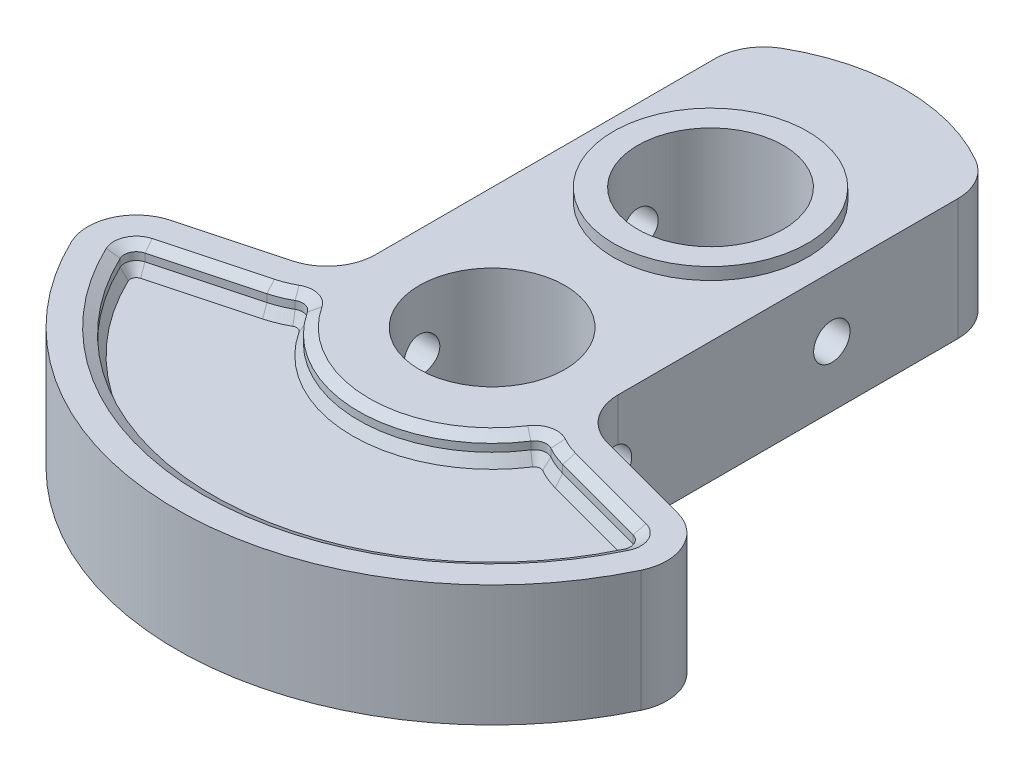
from build123d import *
from OCP.BRepFilletAPI import BRepFilletAPI_MakeChamfer

# Parameters (mm, degrees)
BOSS_EXTRUDE1_DEPTH       = 5
FILLET1_R                 = 4
SKETCH2_R                 = 8
BOSS_EXTRUDE2_DEPTH       = 1
SKETCH3_R                 = 8
BOSS_EXTRUDE3_DEPTH       = 1
SKETCH4_R                 = 6
CUT_EXTRUDE1_DEPTH        = 44.235891121
CUT_EXTRUDE2_DEPTH        = 2
CHAMFER1_SIZE             = 0.5
CHAMFER1_SIZE2            = 0.866025404
CHAMFER1_OF_MIRROR1_SIZE  = 0.5
CHAMFER1_OF_MIRROR1_SIZE2 = 0.866025404
CUT_EXTRUDE3_DEPTH        = 42.968348563
CUT_EXTRUDE3_DEPTH_BACK   = 42.968348563
SKETCH6_R                 = 1.5


with BuildPart() as part:
    # Sketch1 → Boss-Extrude1 (new, symmetric)
    with BuildSketch(Plane(origin=(0, 0, 0), x_dir=(1, 0, 0), z_dir=(0, 1, 0))):
        with BuildLine():
            Line((-10, 30.489995997), (-10, -2.679491924))
            Line((-10, -2.679491924), (-25.114071484, -6.729295173))
            ThreePointArc((-25.114071484, -6.729295173), (0, -26), (25.114071484, -6.729295173))
            Line((25.114071484, -6.729295173), (10, -2.679491924))
            Line((10, -2.679491924), (10, 30.489995997))
            ThreePointArc((10, 30.489995997), (0, 34), (-10, 30.489995997))
        make_face()
    extrude(amount=BOSS_EXTRUDE1_DEPTH, both=True)

    # Fillet1
    fillet1_edges = [part.edges().sort_by_distance(p)[0] for p in [
        (10, 0, -30.489995997),
        (10, 0, 2.679491924),
        (25.114071484, 0, 6.729295173),
        (-25.114071484, 0, 6.729295173),
        (-10, 0, 2.679491924),
        (-10, 0, -30.489995997),
    ]]
    fillet(fillet1_edges, radius=FILLET1_R)

    # Sketch2 → Boss-Extrude2 (add)
    with BuildSketch(Plane.XZ.offset(5)):
        with Locations(Location((0, 0, 0), (0, 0, 270))):
            Circle(SKETCH2_R)
    extrude(amount=BOSS_EXTRUDE2_DEPTH)

    # Sketch3 → Boss-Extrude3 (add)
    with BuildSketch(Plane(origin=(0, 5, 0), x_dir=(1, 0, 0), z_dir=(0, 1, 0))):
        with Locations(Location((0, 18, 0), (0, 0, 270))):
            Circle(SKETCH3_R)
    extrude(amount=BOSS_EXTRUDE3_DEPTH)

    # Sketch4 → Cut-Extrude1 (cut, through all)
    with BuildSketch(Plane.XZ.offset(6)):
        with Locations(Location((0, 0, 0), (0, 0, 270))):
            Circle(SKETCH4_R)
        with Locations(Location((0, -18, 0), (0, 0, 270))):
            Circle(SKETCH4_R)
    extrude(amount=-CUT_EXTRUDE1_DEPTH, mode=Mode.SUBTRACT)

    # Sketch5 → Cut-Extrude2 (cut)
    with BuildSketch(Plane(origin=(0, 5, 0), x_dir=(1, 0, 0), z_dir=(0, 1, 0))):
        with BuildLine():
            Line((12.188266684, -6.371664756), (20.119713435, -8.496889508))
            ThreePointArc((20.119713435, -8.496889508), (20.768948696, -9.043962883), (20.763662316, -9.892943304))
            ThreePointArc((20.763662316, -9.892943304), (0, -23), (-20.763662316, -9.892943304))
            ThreePointArc((-20.763662316, -9.892943304), (-20.768948696, -9.043962883), (-20.119713435, -8.496889508))
            Line((-20.119713435, -8.496889508), (-12.188266684, -6.371664756))
            ThreePointArc((-12.188266684, -6.371664756), (-11.342355786, -6.086056673), (-10.539679728, -5.695098402))
            ThreePointArc((-10.539679728, -5.695098402), (-9.810114884, -5.592432974), (-9.208235905, -6.017340901))
            ThreePointArc((-9.208235905, -6.017340901), (0, -11), (9.208235905, -6.017340901))
            ThreePointArc((9.208235905, -6.017340901), (9.810114884, -5.592432974), (10.539679728, -5.695098402))
            ThreePointArc((10.539679728, -5.695098402), (11.342355786, -6.086056673), (12.188266684, -6.371664756))
        make_face()
    cut_extrude2 = extrude(amount=-CUT_EXTRUDE2_DEPTH, mode=Mode.SUBTRACT)

    # Chamfer1: one chamfer whose edges measure the first distance from different faces: ONE call of the kernel's chamfer builder (chamfer() names one face for all edges)
    chamfer1_edges_1 = [part.edges().sort_by_distance(p)[0] for p in [
        (9.810114884, 3, 5.592432974),
        (11.342355786, 3, 6.086056673),
        (16.153990059, 3, 7.434277132),
        (20.768948696, 3, 9.043962883),
        (0, 3, 23),
        (-20.768948696, 3, 9.043962883),
        (-16.153990059, 3, 7.434277132),
        (-11.342355786, 3, 6.086056673),
        (-9.810114884, 3, 5.592432974),
        (0, 3, 11),
    ]]
    chamfer1_side_1 = [part.faces().sort_by_distance(p)[0] for p in [
        (0, 3, 14.19755549),
    ]]
    chamfer1_edges_2 = [part.edges().sort_by_distance(p)[0] for p in [
        (9.810114884, 5, 5.592432974),
    ]]
    chamfer1_side_2 = [part.faces().sort_by_distance(p)[0] for p in [
        (9.810114884, 4, 5.592432974),
    ]]
    chamfer1_edges_3 = [part.edges().sort_by_distance(p)[0] for p in [
        (0, 5, 11),
    ]]
    chamfer1_side_3 = [part.faces().sort_by_distance(p)[0] for p in [
        (0, 4, 11),
    ]]
    chamfer1_edges_4 = [part.edges().sort_by_distance(p)[0] for p in [
        (-9.810114884, 5, 5.592432974),
    ]]
    chamfer1_side_4 = [part.faces().sort_by_distance(p)[0] for p in [
        (-9.810114884, 4, 5.592432974),
    ]]
    chamfer1_edges_5 = [part.edges().sort_by_distance(p)[0] for p in [
        (-11.342355786, 5, 6.086056673),
    ]]
    chamfer1_side_5 = [part.faces().sort_by_distance(p)[0] for p in [
        (-11.342355786, 4, 6.086056673),
    ]]
    chamfer1_edges_6 = [part.edges().sort_by_distance(p)[0] for p in [
        (-16.153990059, 5, 7.434277132),
    ]]
    chamfer1_side_6 = [part.faces().sort_by_distance(p)[0] for p in [
        (-16.153990059, 4, 7.434277132),
    ]]
    chamfer1_edges_7 = [part.edges().sort_by_distance(p)[0] for p in [
        (-20.768948696, 5, 9.043962883),
    ]]
    chamfer1_side_7 = [part.faces().sort_by_distance(p)[0] for p in [
        (-20.768948696, 4, 9.043962883),
    ]]
    chamfer1_edges_8 = [part.edges().sort_by_distance(p)[0] for p in [
        (0, 5, 23),
    ]]
    chamfer1_side_8 = [part.faces().sort_by_distance(p)[0] for p in [
        (0, 4, 23),
    ]]
    chamfer1_edges_9 = [part.edges().sort_by_distance(p)[0] for p in [
        (20.768948696, 5, 9.043962883),
    ]]
    chamfer1_side_9 = [part.faces().sort_by_distance(p)[0] for p in [
        (20.768948696, 4, 9.043962883),
    ]]
    chamfer1_edges_10 = [part.edges().sort_by_distance(p)[0] for p in [
        (16.153990059, 5, 7.434277132),
    ]]
    chamfer1_side_10 = [part.faces().sort_by_distance(p)[0] for p in [
        (16.153990059, 4, 7.434277132),
    ]]
    chamfer1_edges_11 = [part.edges().sort_by_distance(p)[0] for p in [
        (11.342355786, 5, 6.086056673),
    ]]
    chamfer1_side_11 = [part.faces().sort_by_distance(p)[0] for p in [
        (11.342355786, 4, 6.086056673),
    ]]
    chamfer1 = BRepFilletAPI_MakeChamfer(part.part.solid().wrapped)
    for e in chamfer1_edges_1:
        chamfer1.Add(CHAMFER1_SIZE, CHAMFER1_SIZE2, e.wrapped, chamfer1_side_1[0].wrapped)  # the first distance lies on this face
    for e in chamfer1_edges_2:
        chamfer1.Add(CHAMFER1_SIZE, CHAMFER1_SIZE2, e.wrapped, chamfer1_side_2[0].wrapped)  # the first distance lies on this face
    for e in chamfer1_edges_3:
        chamfer1.Add(CHAMFER1_SIZE, CHAMFER1_SIZE2, e.wrapped, chamfer1_side_3[0].wrapped)  # the first distance lies on this face
    for e in chamfer1_edges_4:
        chamfer1.Add(CHAMFER1_SIZE, CHAMFER1_SIZE2, e.wrapped, chamfer1_side_4[0].wrapped)  # the first distance lies on this face
    for e in chamfer1_edges_5:
        chamfer1.Add(CHAMFER1_SIZE, CHAMFER1_SIZE2, e.wrapped, chamfer1_side_5[0].wrapped)  # the first distance lies on this face
    for e in chamfer1_edges_6:
        chamfer1.Add(CHAMFER1_SIZE, CHAMFER1_SIZE2, e.wrapped, chamfer1_side_6[0].wrapped)  # the first distance lies on this face
    for e in chamfer1_edges_7:
        chamfer1.Add(CHAMFER1_SIZE, CHAMFER1_SIZE2, e.wrapped, chamfer1_side_7[0].wrapped)  # the first distance lies on this face
    for e in chamfer1_edges_8:
        chamfer1.Add(CHAMFER1_SIZE, CHAMFER1_SIZE2, e.wrapped, chamfer1_side_8[0].wrapped)  # the first distance lies on this face
    for e in chamfer1_edges_9:
        chamfer1.Add(CHAMFER1_SIZE, CHAMFER1_SIZE2, e.wrapped, chamfer1_side_9[0].wrapped)  # the first distance lies on this face
    for e in chamfer1_edges_10:
        chamfer1.Add(CHAMFER1_SIZE, CHAMFER1_SIZE2, e.wrapped, chamfer1_side_10[0].wrapped)  # the first distance lies on this face
    for e in chamfer1_edges_11:
        chamfer1.Add(CHAMFER1_SIZE, CHAMFER1_SIZE2, e.wrapped, chamfer1_side_11[0].wrapped)  # the first distance lies on this face
    add(Compound.cast(chamfer1.Shape()), mode=Mode.REPLACE)

    # Mirror1: Cut-Extrude2 across plane
    add(cut_extrude2.mirror(Plane.ZX), mode=Mode.SUBTRACT)

    # Chamfer1 of Mirror1: one chamfer whose edges measure the first distance from different faces: ONE call of the kernel's chamfer builder (chamfer() names one face for all edges)
    chamfer1_of_mirror1_edges_1 = [part.edges().sort_by_distance(p)[0] for p in [
        (9.810114884, -3, 5.592432974),
        (11.342355786, -3, 6.086056673),
        (16.153990059, -3, 7.434277132),
        (20.768948696, -3, 9.043962883),
        (0, -3, 23),
        (-20.768948696, -3, 9.043962883),
        (-16.153990059, -3, 7.434277132),
        (-11.342355786, -3, 6.086056673),
        (-9.810114884, -3, 5.592432974),
        (0, -3, 11),
    ]]
    chamfer1_of_mirror1_side_1 = [part.faces().sort_by_distance(p)[0] for p in [
        (0, -3, 14.19755549),
    ]]
    chamfer1_of_mirror1_edges_2 = [part.edges().sort_by_distance(p)[0] for p in [
        (9.810114884, -5, 5.592432974),
    ]]
    chamfer1_of_mirror1_side_2 = [part.faces().sort_by_distance(p)[0] for p in [
        (9.810114884, -4, 5.592432974),
    ]]
    chamfer1_of_mirror1_edges_3 = [part.edges().sort_by_distance(p)[0] for p in [
        (0, -5, 11),
    ]]
    chamfer1_of_mirror1_side_3 = [part.faces().sort_by_distance(p)[0] for p in [
        (0, -4, 11),
    ]]
    chamfer1_of_mirror1_edges_4 = [part.edges().sort_by_distance(p)[0] for p in [
        (-9.810114884, -5, 5.592432974),
    ]]
    chamfer1_of_mirror1_side_4 = [part.faces().sort_by_distance(p)[0] for p in [
        (-9.810114884, -4, 5.592432974),
    ]]
    chamfer1_of_mirror1_edges_5 = [part.edges().sort_by_distance(p)[0] for p in [
        (-11.342355786, -5, 6.086056673),
    ]]
    chamfer1_of_mirror1_side_5 = [part.faces().sort_by_distance(p)[0] for p in [
        (-11.342355786, -4, 6.086056673),
    ]]
    chamfer1_of_mirror1_edges_6 = [part.edges().sort_by_distance(p)[0] for p in [
        (-16.153990059, -5, 7.434277132),
    ]]
    chamfer1_of_mirror1_side_6 = [part.faces().sort_by_distance(p)[0] for p in [
        (-16.153990059, -4, 7.434277132),
    ]]
    chamfer1_of_mirror1_edges_7 = [part.edges().sort_by_distance(p)[0] for p in [
        (-20.768948696, -5, 9.043962883),
    ]]
    chamfer1_of_mirror1_side_7 = [part.faces().sort_by_distance(p)[0] for p in [
        (-20.768948696, -4, 9.043962883),
    ]]
    chamfer1_of_mirror1_edges_8 = [part.edges().sort_by_distance(p)[0] for p in [
        (0, -5, 23),
    ]]
    chamfer1_of_mirror1_side_8 = [part.faces().sort_by_distance(p)[0] for p in [
        (0, -4, 23),
    ]]
    chamfer1_of_mirror1_edges_9 = [part.edges().sort_by_distance(p)[0] for p in [
        (20.768948696, -5, 9.043962883),
    ]]
    chamfer1_of_mirror1_side_9 = [part.faces().sort_by_distance(p)[0] for p in [
        (20.768948696, -4, 9.043962883),
    ]]
    chamfer1_of_mirror1_edges_10 = [part.edges().sort_by_distance(p)[0] for p in [
        (16.153990059, -5, 7.434277132),
    ]]
    chamfer1_of_mirror1_side_10 = [part.faces().sort_by_distance(p)[0] for p in [
        (16.153990059, -4, 7.434277132),
    ]]
    chamfer1_of_mirror1_edges_11 = [part.edges().sort_by_distance(p)[0] for p in [
        (11.342355786, -5, 6.086056673),
    ]]
    chamfer1_of_mirror1_side_11 = [part.faces().sort_by_distance(p)[0] for p in [
        (11.342355786, -4, 6.086056673),
    ]]
    chamfer1_of_mirror1 = BRepFilletAPI_MakeChamfer(part.part.solid().wrapped)
    for e in chamfer1_of_mirror1_edges_1:
        chamfer1_of_mirror1.Add(CHAMFER1_OF_MIRROR1_SIZE, CHAMFER1_OF_MIRROR1_SIZE2, e.wrapped, chamfer1_of_mirror1_side_1[0].wrapped)  # the first distance lies on this face
    for e in chamfer1_of_mirror1_edges_2:
        chamfer1_of_mirror1.Add(CHAMFER1_OF_MIRROR1_SIZE, CHAMFER1_OF_MIRROR1_SIZE2, e.wrapped, chamfer1_of_mirror1_side_2[0].wrapped)  # the first distance lies on this face
    for e in chamfer1_of_mirror1_edges_3:
        chamfer1_of_mirror1.Add(CHAMFER1_OF_MIRROR1_SIZE, CHAMFER1_OF_MIRROR1_SIZE2, e.wrapped, chamfer1_of_mirror1_side_3[0].wrapped)  # the first distance lies on this face
    for e in chamfer1_of_mirror1_edges_4:
        chamfer1_of_mirror1.Add(CHAMFER1_OF_MIRROR1_SIZE, CHAMFER1_OF_MIRROR1_SIZE2, e.wrapped, chamfer1_of_mirror1_side_4[0].wrapped)  # the first distance lies on this face
    for e in chamfer1_of_mirror1_edges_5:
        chamfer1_of_mirror1.Add(CHAMFER1_OF_MIRROR1_SIZE, CHAMFER1_OF_MIRROR1_SIZE2, e.wrapped, chamfer1_of_mirror1_side_5[0].wrapped)  # the first distance lies on this face
    for e in chamfer1_of_mirror1_edges_6:
        chamfer1_of_mirror1.Add(CHAMFER1_OF_MIRROR1_SIZE, CHAMFER1_OF_MIRROR1_SIZE2, e.wrapped, chamfer1_of_mirror1_side_6[0].wrapped)  # the first distance lies on this face
    for e in chamfer1_of_mirror1_edges_7:
        chamfer1_of_mirror1.Add(CHAMFER1_OF_MIRROR1_SIZE, CHAMFER1_OF_MIRROR1_SIZE2, e.wrapped, chamfer1_of_mirror1_side_7[0].wrapped)  # the first distance lies on this face
    for e in chamfer1_of_mirror1_edges_8:
        chamfer1_of_mirror1.Add(CHAMFER1_OF_MIRROR1_SIZE, CHAMFER1_OF_MIRROR1_SIZE2, e.wrapped, chamfer1_of_mirror1_side_8[0].wrapped)  # the first distance lies on this face
    for e in chamfer1_of_mirror1_edges_9:
        chamfer1_of_mirror1.Add(CHAMFER1_OF_MIRROR1_SIZE, CHAMFER1_OF_MIRROR1_SIZE2, e.wrapped, chamfer1_of_mirror1_side_9[0].wrapped)  # the first distance lies on this face
    for e in chamfer1_of_mirror1_edges_10:
        chamfer1_of_mirror1.Add(CHAMFER1_OF_MIRROR1_SIZE, CHAMFER1_OF_MIRROR1_SIZE2, e.wrapped, chamfer1_of_mirror1_side_10[0].wrapped)  # the first distance lies on this face
    for e in chamfer1_of_mirror1_edges_11:
        chamfer1_of_mirror1.Add(CHAMFER1_OF_MIRROR1_SIZE, CHAMFER1_OF_MIRROR1_SIZE2, e.wrapped, chamfer1_of_mirror1_side_11[0].wrapped)  # the first distance lies on this face
    add(Compound.cast(chamfer1_of_mirror1.Shape()), mode=Mode.REPLACE)

    # Sketch6 → Cut-Extrude3 (cut, two sides: drawn at the far end of the back side and taken through both)
    with BuildSketch(Plane(origin=(0, 0, 0), x_dir=(0, 0, -1), z_dir=(1, 0, 0)).offset(-CUT_EXTRUDE3_DEPTH_BACK)):
        Circle(SKETCH6_R)
        with Locations((18, 0)):
            Circle(SKETCH6_R)
    extrude(amount=CUT_EXTRUDE3_DEPTH + CUT_EXTRUDE3_DEPTH_BACK, mode=Mode.SUBTRACT)


solid = part.part
